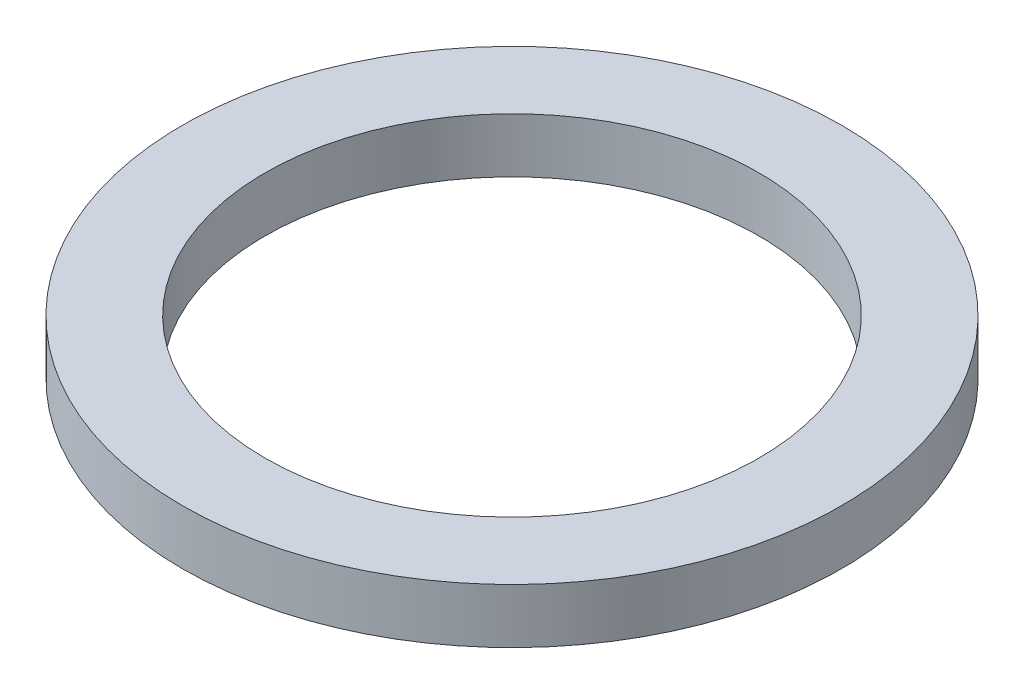
from build123d import *

# Parameters (mm, degrees)
SKETCH1_R           = 38.2905
SKETCH1_R_2         = 28.702
BOSS_EXTRUDE1_DEPTH = 6.35


with BuildPart() as part:
    # Sketch1 → Boss-Extrude1 (new body)
    with BuildSketch(Plane(origin=(0, 0, 0), x_dir=(1, 0, 0), z_dir=(0, 1, 0))):
        with Locations(Location((0, 0, 0), (0, 0, 270))):
            Circle(SKETCH1_R)
        with Locations(Location((0, 0, 0), (0, 0, 270))):
            Circle(SKETCH1_R_2, mode=Mode.SUBTRACT)
    extrude(amount=BOSS_EXTRUDE1_DEPTH)


solid = part.part
